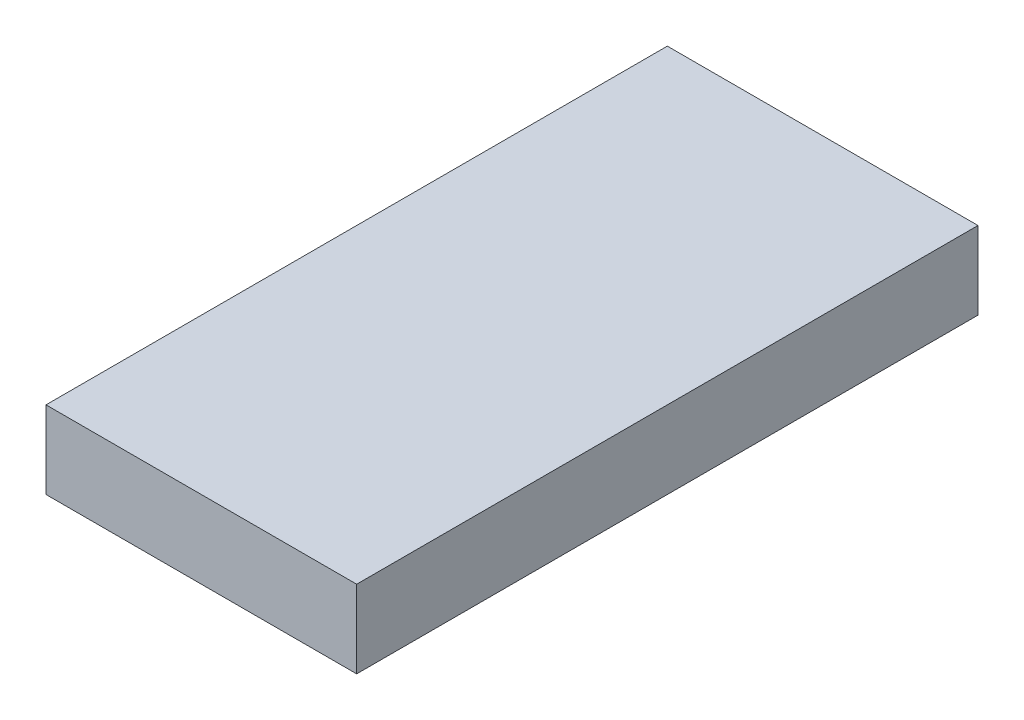
from build123d import *

# Parameters (mm, degrees)
SKETCH_1_W      = 20
SKETCH_1_H      = 40
EXTRUDE_1_DEPTH = 5


with BuildPart() as part:
    # 草图1 → 凸台-拉伸1 (new body)
    with BuildSketch(Plane(origin=(0, 0, 0), x_dir=(1, 0, 0), z_dir=(0, 1, 0))):
        Rectangle(SKETCH_1_W, SKETCH_1_H)
    extrude(amount=EXTRUDE_1_DEPTH)


solid = part.part
